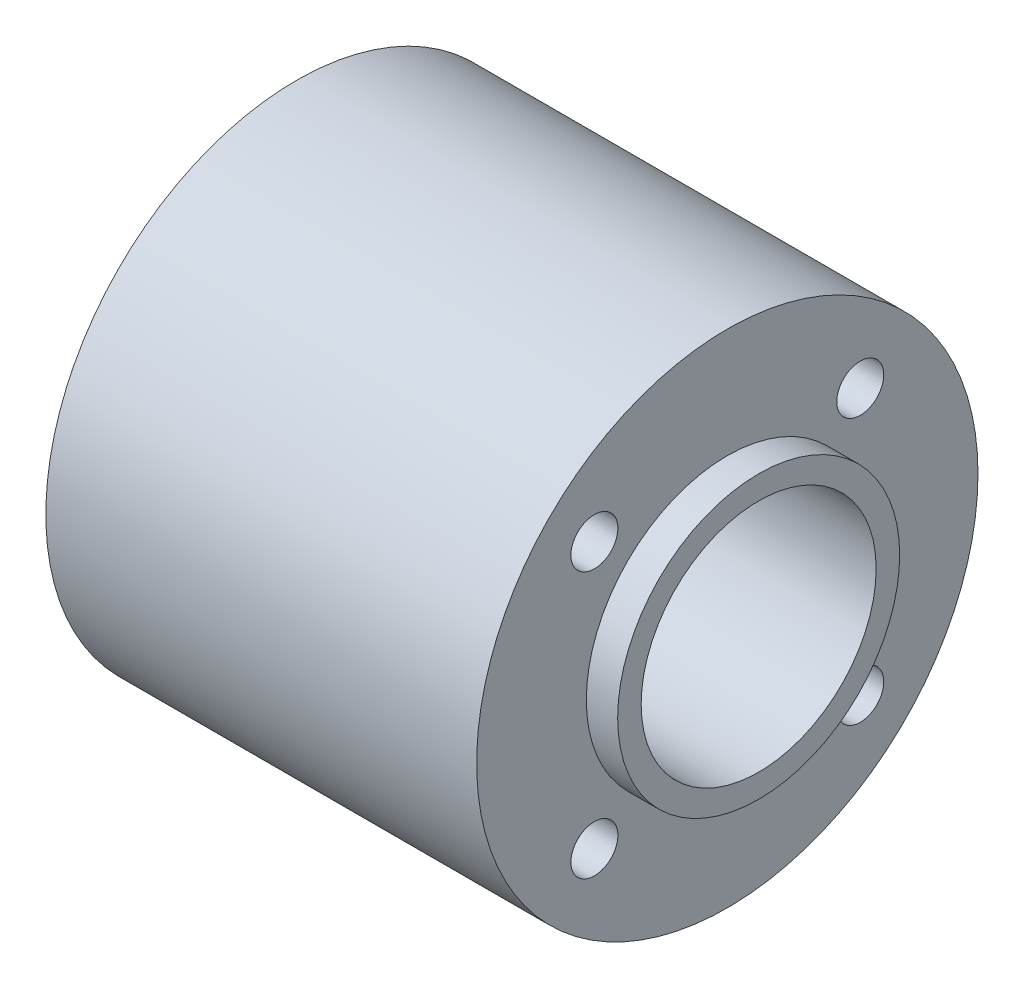
from build123d import *

# Parameters (mm, degrees)
SKETCH_1_R      = 16
SKETCH_1_R_2    = 7.5
SKETCH_1_R_3    = 1.5
EXTRUDE_1_DEPTH = 13.75
SKETCH_6_R      = 9
SKETCH_6_R_2    = 7.5
EXTRUDE_7_DEPTH = 2


with BuildPart() as part:
    # 草图1 → 凸台-拉伸1 (new, symmetric)
    with BuildSketch(Plane(origin=(0, 0, 0), x_dir=(0, 0, -1), z_dir=(1, 0, 0))):
        Circle(SKETCH_1_R)
        Circle(SKETCH_1_R_2, mode=Mode.SUBTRACT)
        with Locations((-8.485281374, 8.485281374)):
            Circle(SKETCH_1_R_3, mode=Mode.SUBTRACT)
        with Locations((8.485281374, 8.485281374)):
            Circle(SKETCH_1_R_3, mode=Mode.SUBTRACT)
        with Locations((8.485281374, -8.485281374)):
            Circle(SKETCH_1_R_3, mode=Mode.SUBTRACT)
        with Locations((-8.485281374, -8.485281374)):
            Circle(SKETCH_1_R_3, mode=Mode.SUBTRACT)
    extrude(amount=EXTRUDE_1_DEPTH, both=True)

    # 草图6 → 凸台-拉伸7 (add)
    with BuildSketch(Plane(origin=(13.75, 0, 0), x_dir=(0, 0, -1), z_dir=(1, 0, 0))):
        Circle(SKETCH_6_R)
        Circle(SKETCH_6_R_2, mode=Mode.SUBTRACT)
    extrude_7 = extrude(amount=EXTRUDE_7_DEPTH)

    # 镜向2: 凸台-拉伸7 across plane
    add(extrude_7.mirror(Plane(origin=(0, 0, 0), x_dir=(0, 0, 1), z_dir=(1, 0, 0))))


solid = part.part
